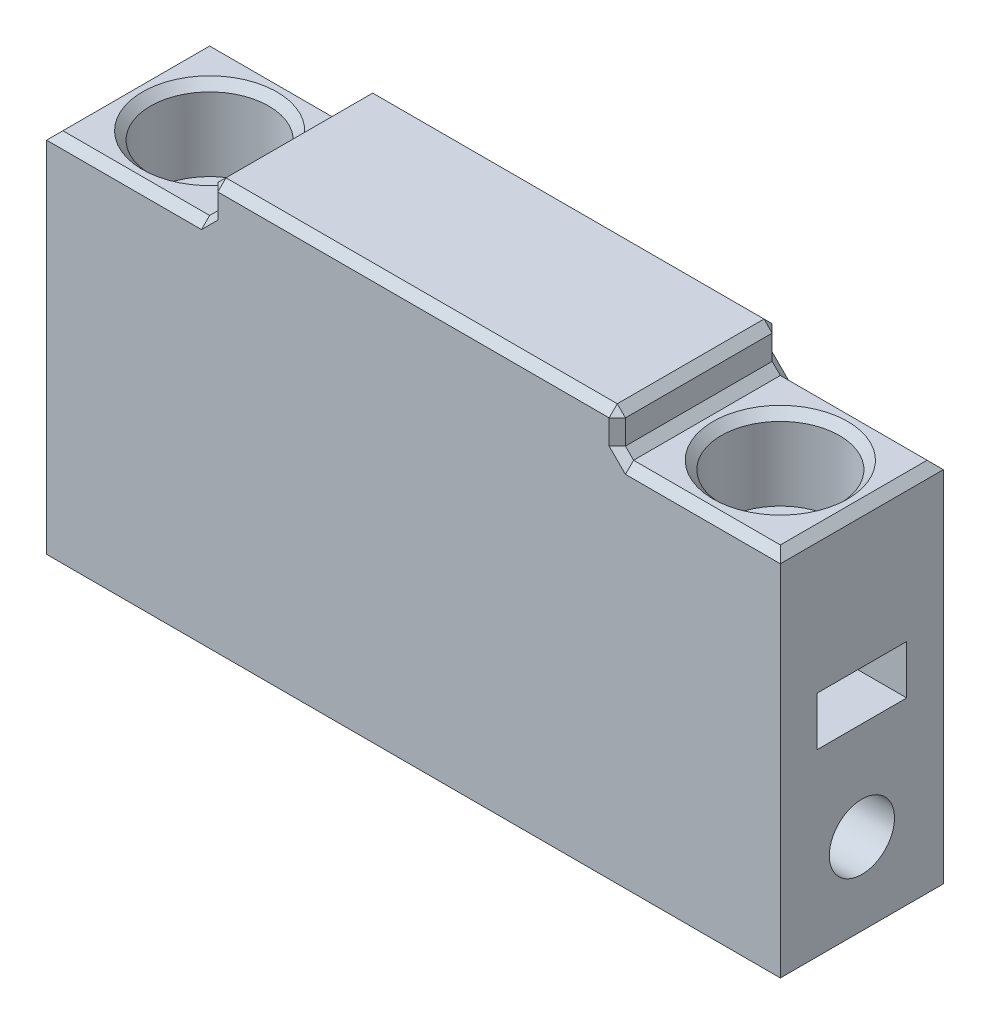
from build123d import *

# Parameters (mm, degrees)
BODY_DEPTH             = 10
SKETCH14_R             = 7.5
BEARING_SUPPORT_DEPTH  = 7
SKETCH15_R             = 7.5
SKETCH15_R_2           = 4.7
BEARING_PLACE_DEPTH    = 4
SKETCH16_R             = 2
MOTOR_SHAFT_HOLE_DEPTH = 3
FILLET1_R              = 6
SKETCH17_R             = 7.25
SPRING_HOLE_DEPTH      = 10
SKETCH18_W             = 11
SKETCH18_H             = 6
NUT_HOLE_DEPTH         = 20
SKETCH19_R             = 3.25
SHAFT_HOLE_DEPTH       = 13
SKETCH20_R             = 4
BRAKE_SCREW_HOLE_DEPTH = 20
SKETCH21_W             = 6
SKETCH21_H             = 11
BRAKE_NUT_HOLE_DEPTH   = 20
CHAMFER1_SIZE          = 1


with BuildPart() as part:
    # Sketch1 → Body (new, symmetric)
    with BuildSketch(Plane.XY):
        Polygon((25, -25), (-25, -25), (-45, -25), (-45, 20), (-25, 20), (-25, 25), (25, 25), (25, 20), (45, 20), (45, -25), align=None)
    extrude(amount=BODY_DEPTH, both=True)

    # Sketch14 → Bearing_Support (add)
    with BuildSketch(Plane(origin=(0, 0, -10), x_dir=(-1, 0, 0), z_dir=(0, 0, -1))):
        Circle(SKETCH14_R)
    extrude(amount=BEARING_SUPPORT_DEPTH)

    # Sketch15 → Bearing_Place (add)
    with BuildSketch(Plane(origin=(0, 0, -17), x_dir=(-1, 0, 0), z_dir=(0, 0, -1))):
        Circle(SKETCH15_R)
        Circle(SKETCH15_R_2, mode=Mode.SUBTRACT)
    extrude(amount=BEARING_PLACE_DEPTH)

    # Sketch16 → Motor_Shaft_Hole (cut)
    with BuildSketch(Plane(origin=(0, 0, -17), x_dir=(-1, 0, 0), z_dir=(0, 0, -1))):
        Circle(SKETCH16_R)
    extrude(amount=-MOTOR_SHAFT_HOLE_DEPTH, mode=Mode.SUBTRACT)

    # Fillet1
    fillet1_edges = [part.edges().sort_by_distance(p)[0] for p in [
        (7.5, 0, -10),
    ]]
    fillet(fillet1_edges, radius=FILLET1_R)

    # Sketch17 → Spring_Hole (cut)
    with BuildSketch(Plane(origin=(0, 20, 0), x_dir=(1, 0, 0), z_dir=(0, 1, 0))):
        with Locations(Location((-35, 0, 0), (0, 0, 180))):
            Circle(SKETCH17_R)
    spring_hole = extrude(amount=-SPRING_HOLE_DEPTH, mode=Mode.SUBTRACT)

    # Sketch18 → Nut_Hole (cut)
    with BuildSketch(Plane.ZY.offset(45)):
        Rectangle(SKETCH18_W, SKETCH18_H)
    nut_hole = extrude(amount=-NUT_HOLE_DEPTH, mode=Mode.SUBTRACT)

    # Sketch19 → Shaft_Hole (cut)
    with BuildSketch(Plane(origin=(0, 10, 0), x_dir=(1, 0, 0), z_dir=(0, 1, 0))):
        with Locations(Location((-35, 0, 0), (0, 0, 180))):
            Circle(SKETCH19_R)
    shaft_hole = extrude(amount=-SHAFT_HOLE_DEPTH, mode=Mode.SUBTRACT)

    # Sketch20 → Brake_Screw_Hole (cut)
    with BuildSketch(Plane(origin=(45, 0, 0), x_dir=(0, 0, -1), z_dir=(1, 0, 0))):
        with Locations(Location((0, -15, 0), (0, 0, 90))):
            Circle(SKETCH20_R)
    brake_screw_hole = extrude(amount=-BRAKE_SCREW_HOLE_DEPTH, mode=Mode.SUBTRACT)

    # Sketch21 → Brake_Nut_Hole (cut)
    with BuildSketch(Plane.XZ.offset(25)):
        with Locations((28, 0)):
            Rectangle(SKETCH21_W, SKETCH21_H)
    brake_nut_hole = extrude(amount=-BRAKE_NUT_HOLE_DEPTH, mode=Mode.SUBTRACT)

    # Mirror1: Spring_Hole, Nut_Hole, Shaft_Hole, Brake_Screw_Hole, Brake_Nut_Hole across plane
    add(spring_hole.mirror(Plane(origin=(0, 0, 0), x_dir=(0, 0, 1), z_dir=(1, 0, 0))), mode=Mode.SUBTRACT)
    add(nut_hole.mirror(Plane(origin=(0, 0, 0), x_dir=(0, 0, 1), z_dir=(1, 0, 0))), mode=Mode.SUBTRACT)
    add(shaft_hole.mirror(Plane(origin=(0, 0, 0), x_dir=(0, 0, 1), z_dir=(1, 0, 0))), mode=Mode.SUBTRACT)
    add(brake_screw_hole.mirror(Plane(origin=(0, 0, 0), x_dir=(0, 0, 1), z_dir=(1, 0, 0))), mode=Mode.SUBTRACT)
    add(brake_nut_hole.mirror(Plane(origin=(0, 0, 0), x_dir=(0, 0, 1), z_dir=(1, 0, 0))), mode=Mode.SUBTRACT)

    # Chamfer1
    chamfer1_edges = [part.edges().sort_by_distance(p)[0] for p in [
        (25, 22.5, -10),
        (35, 20, -10),
        (-35, 20, 10),
        (-35, 20, -10),
        (-25, 22.5, -10),
        (0, 25, -10),
        (25, 25, 0),
        (25, 20, 0),
        (45, 20, 0),
        (-45, 20, 0),
        (-25, 20, 0),
        (-25, 25, 0),
        (35, 20, 10),
        (25, 22.5, 10),
        (0, 25, 10),
        (-27.75, 20, 0),
        (-25, 22.5, 10),
        (27.75, 20, 0),
    ]]
    chamfer(chamfer1_edges, length=CHAMFER1_SIZE)


solid = part.part
